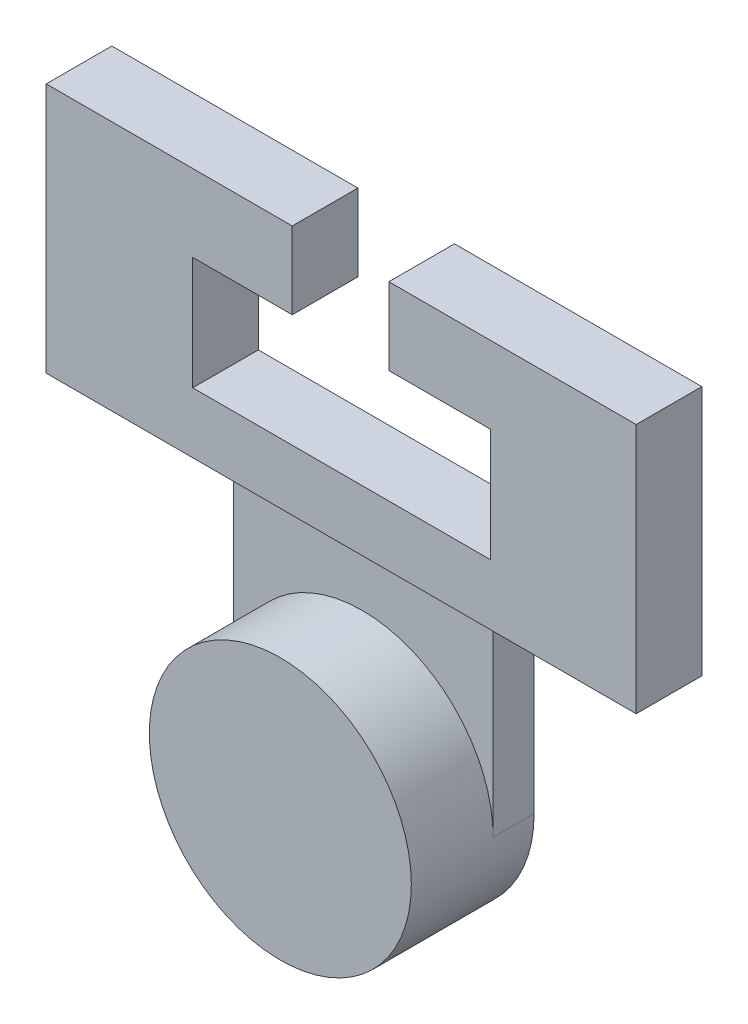
from build123d import *

# Parameters (mm, degrees)
SKETCH1_R           = 10.16
BOSS_EXTRUDE1_DEPTH = 9.525
SKETCH2_W           = 20.151524415
SKETCH2_H           = 15.754496301
BOSS_EXTRUDE4_DEPTH = 3.175
BOSS_EXTRUDE5_DEPTH = 4.699
SKETCH4_W           = 11.36474419
SKETCH4_H           = 5.089940764
SKETCH4_W_2         = 11.314127359
BOSS_EXTRUDE6_DEPTH = 8.763
SKETCH5_W           = 19.083811061
SKETCH5_H           = 5.089940764
SKETCH5_W_2         = 19.185044725
BOSS_EXTRUDE7_DEPTH = 5.969


with BuildPart() as part:
    # Sketch1 → Boss-Extrude1 (new body)
    with BuildSketch(Plane.XY):
        Circle(SKETCH1_R)
    extrude(amount=-BOSS_EXTRUDE1_DEPTH)

    # Sketch2 → Boss-Extrude4 (add)
    with BuildSketch(Plane(origin=(0, 0, -9.525), x_dir=(-1, 0, 0), z_dir=(0, 0, -1))):
        with Locations((-0.084237792, 7.877248151)):
            Rectangle(SKETCH2_W, SKETCH2_H)
    extrude(amount=-BOSS_EXTRUDE4_DEPTH)

    # Sketch3 → Boss-Extrude5 (add)
    with BuildSketch(Plane(origin=(0, 15.754496301, 0), x_dir=(1, 0, 0), z_dir=(0, 1, 0))):
        Polygon((-9.991524415, 9.525), (-22.594029854, 9.525), (-22.594029854, 4.435059236), (23.166117059, 4.435059236), (23.166117059, 9.525), align=None)
    extrude(amount=BOSS_EXTRUDE5_DEPTH)

    # Sketch4 → Boss-Extrude6 (add)
    with BuildSketch(Plane(origin=(0, 20.453496301, 0), x_dir=(1, 0, 0), z_dir=(0, 1, 0))):
        with Locations((-16.911657759, 6.980029618)):
            Rectangle(SKETCH4_W, SKETCH4_H)
        with Locations((17.50905338, 6.980029618)):
            Rectangle(SKETCH4_W_2, SKETCH4_H)
    extrude(amount=BOSS_EXTRUDE6_DEPTH)

    # Sketch5 → Boss-Extrude7 (add)
    with BuildSketch(Plane(origin=(0, 29.216496301, 0), x_dir=(1, 0, 0), z_dir=(0, 1, 0))):
        with Locations((-13.052124324, 6.980029618)):
            Rectangle(SKETCH5_W, SKETCH5_H)
        with Locations((13.573594697, 6.980029618)):
            Rectangle(SKETCH5_W_2, SKETCH5_H)
    extrude(amount=BOSS_EXTRUDE7_DEPTH)


solid = part.part
